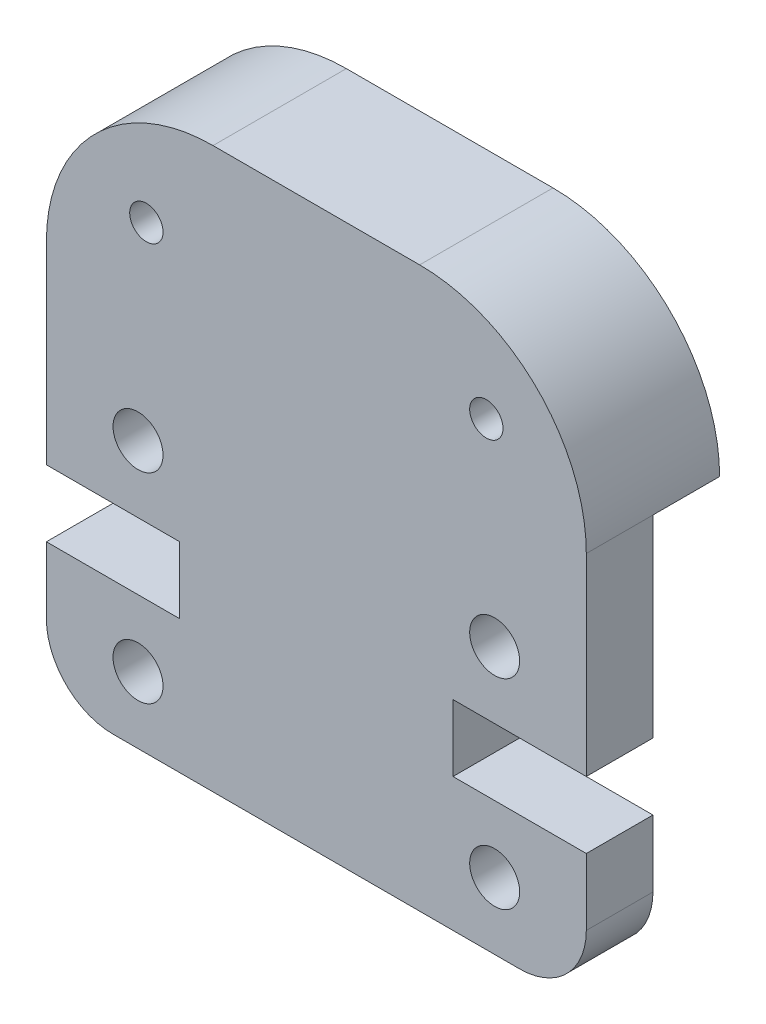
from build123d import *

# Parameters (mm, degrees)
SKETCH1_R           = 0.75
SKETCH1_R_2         = 0.5
BOSS_EXTRUDE1_DEPTH = 4
SKETCH2_W           = 16.2
SKETCH2_H           = 11.795
CUT_EXTRUDE1_DEPTH  = 2


with BuildPart() as part:
    # Sketch1 → Boss-Extrude1 (new body)
    with BuildSketch(Plane.XY):
        with BuildLine():
            Line((0, 6), (0, 11.795))
            ThreePointArc((0, 11.795), (1.464466094, 15.330533906), (5, 16.795))
            Line((5, 16.795), (11.2, 16.795))
            ThreePointArc((11.2, 16.795), (14.735533906, 15.330533906), (16.2, 11.795))
            Line((16.2, 11.795), (16.2, 6))
            Line((16.2, 6), (12.2, 6))
            Line((12.2, 6), (12.2, 4))
            Line((12.2, 4), (16.2, 4))
            Line((16.2, 4), (16.2, 2))
            ThreePointArc((16.2, 2), (15.614213562, 0.585786438), (14.2, 0))
            Line((14.2, 0), (2, 0))
            ThreePointArc((2, 0), (0.585786438, 0.585786438), (0, 2))
            Line((0, 2), (0, 4))
            Line((0, 4), (4, 4))
            Line((4, 4), (4, 6))
            Line((4, 6), (0, 6))
        make_face()
        with Locations((13.45, 2)):
            Circle(SKETCH1_R, mode=Mode.SUBTRACT)
        with Locations((13.45, 8)):
            Circle(SKETCH1_R, mode=Mode.SUBTRACT)
        with Locations((3, 13.795)):
            Circle(SKETCH1_R_2, mode=Mode.SUBTRACT)
        with Locations((13.2, 13.795)):
            Circle(SKETCH1_R_2, mode=Mode.SUBTRACT)
        with Locations((2.75, 8)):
            Circle(SKETCH1_R, mode=Mode.SUBTRACT)
        with Locations((2.75, 2)):
            Circle(SKETCH1_R, mode=Mode.SUBTRACT)
    extrude(amount=BOSS_EXTRUDE1_DEPTH)

    # Sketch2 → Cut-Extrude1 (cut)
    with BuildSketch(Plane.XY):
        with Locations((8.1, 5.8975)):
            Rectangle(SKETCH2_W, SKETCH2_H)
    extrude(amount=CUT_EXTRUDE1_DEPTH, mode=Mode.SUBTRACT)


solid = part.part
